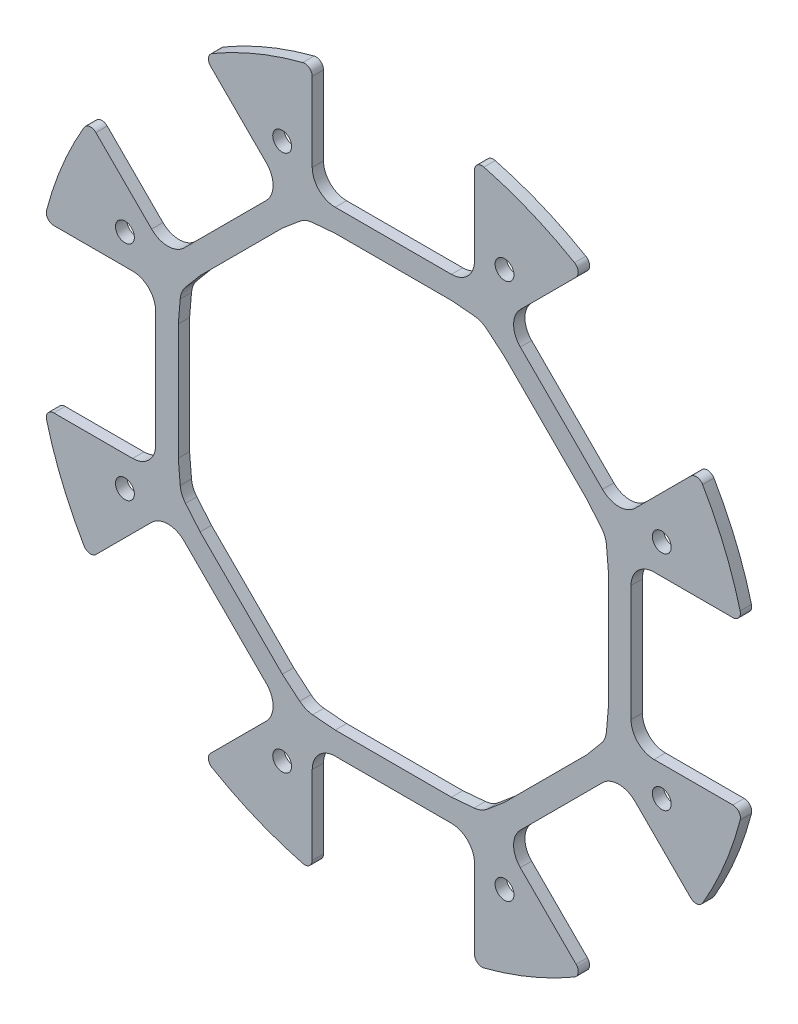
from build123d import *

# Parameters (mm, degrees)
SKETCH_1_R                       = 47.5
EXTRUDE_1_DEPTH                  = 1.5
CUT_EXTRUDE_1_DEPTH              = 68.191889392
CUT_EXTRUDE_2_DEPTH              = 68.191889392
CUT_EXTRUDE_2_DEPTH_BACK         = 68.191889392
SKETCH_3_R                       = 3.1
SKETCH_3_R_2                     = 1.6
SKETCH_4_R                       = 1.25
CUT_EXTRUDE_3_DEPTH              = 68.191889392
CUT_EXTRUDE_4_DEPTH              = 68.191889392
FILLET_1_R                       = 1
FILLET_2_R                       = 0.2
FILLET_3_R                       = 3.05
PATTERN_CIRCULAR_1_COUNT         = 8
FILLET_1_OF_PATTERN_CIRCULAR_1_R = 1
FILLET_2_OF_PATTERN_CIRCULAR_1_R = 0.2
FILLET_3_OF_PATTERN_CIRCULAR_1_R = 3.05
CUT_EXTRUDE_5_DEPTH              = 66.05834985
EXTRUDE_START                    = -1.5
EXTRUDE_2_DEPTH                  = 1.5
FILLET_4_R                       = 3.05
PATTERN_CIRCULAR_2_COUNT         = 8


with BuildPart() as part:
    # ｽｹｯﾁ1 → ﾎﾞｽ - 押し出し1 (new body)
    with BuildSketch(Plane.XY):
        Circle(SKETCH_1_R)
    extrude(amount=EXTRUDE_1_DEPTH)

    # ｽｹｯﾁ2 → ｶｯﾄ - 押し出し1 (cut, through all)
    with BuildSketch(Plane.XY.offset(1.5)):
        Polygon((-10.75, 43.525), (-10.75, 52.5), (10.75, 52.5), (10.75, 43.525), (13, 43.525), (13, 40.475), (10.75, 40.475), (10.75, 31.5), (-10.75, 31.5), (-10.75, 40.475), (-13, 40.475), (-13, 43.525), align=None)
    cut_extrude_1 = extrude(amount=-CUT_EXTRUDE_1_DEPTH, mode=Mode.SUBTRACT)

    # ｽｹｯﾁ3 → ｶｯﾄ - 押し出し2 (cut, two sides: drawn at the far end of the back side and taken through both)
    with BuildSketch(Plane.XY.offset(1.5).offset(-CUT_EXTRUDE_2_DEPTH_BACK)):
        Circle(SKETCH_3_R)
        with Locations((0, 6.5)):
            Circle(SKETCH_3_R_2)
        with Locations((6.5, 0)):
            Circle(SKETCH_3_R_2)
        with Locations((0, -6.5)):
            Circle(SKETCH_3_R_2)
        with Locations((-6.5, 0)):
            Circle(SKETCH_3_R_2)
        with Locations((8.838834765, 8.838834765)):
            Circle(SKETCH_3_R_2)
        with Locations((8.838834765, -8.838834765)):
            Circle(SKETCH_3_R_2)
        with Locations((-8.838834765, -8.838834765)):
            Circle(SKETCH_3_R_2)
        with Locations((-8.838834765, 8.838834765)):
            Circle(SKETCH_3_R_2)
    extrude(amount=CUT_EXTRUDE_2_DEPTH + CUT_EXTRUDE_2_DEPTH_BACK, mode=Mode.SUBTRACT)

    # ｽｹｯﾁ4 → ｶｯﾄ - 押し出し3 (cut, through all)
    with BuildSketch(Plane.XY.offset(1.5)):
        with Locations((14.733312146, 35.569362002)):
            Circle(SKETCH_4_R)
        with Locations((8.610377228, 20.787289482)):
            Circle(SKETCH_4_R)
    cut_extrude_3 = extrude(amount=-CUT_EXTRUDE_3_DEPTH, mode=Mode.SUBTRACT)

    # ｽｹｯﾁ5 → ｶｯﾄ - 押し出し4 (cut, symmetric)
    with BuildSketch(Plane.XY.offset(1.5)):
        Polygon((-7.188286702, 26.5), (7.188286702, 26.5), (3.328075632, 17.180626082), (-3.328075632, 17.180626082), align=None)
    cut_extrude_4 = extrude(amount=CUT_EXTRUDE_4_DEPTH, both=True, mode=Mode.SUBTRACT)

    # ﾌｨﾚｯﾄ1
    fillet_1_edges = [part.edges().sort_by_distance(p)[0] for p in [
        (7.188286702, 26.5, 0.75),
        (3.328075632, 17.180626082, 0.75),
        (-3.328075632, 17.180626082, 0.75),
        (-7.188286702, 26.5, 0.75),
        (10.75, 46.267564232, 0.75),
        (-10.75, 46.267564232, 0.75),
    ]]
    fillet(fillet_1_edges, radius=FILLET_1_R)

    # ﾌｨﾚｯﾄ2
    fillet_2_edges = [part.edges().sort_by_distance(p)[0] for p in [
        (13, 43.525, 0.75),
        (13, 40.475, 0.75),
        (-13, 40.475, 0.75),
        (-13, 43.525, 0.75),
    ]]
    fillet(fillet_2_edges, radius=FILLET_2_R)

    # ﾌｨﾚｯﾄ3
    fillet_3_edges = [part.edges().sort_by_distance(p)[0] for p in [
        (10.75, 31.5, 0.75),
        (-10.75, 31.5, 0.75),
    ]]
    fillet(fillet_3_edges, radius=FILLET_3_R)

    # 円形ﾊﾟﾀｰﾝ1: ｶｯﾄ - 押し出し1, ｶｯﾄ - 押し出し3, ｶｯﾄ - 押し出し4 ×8 about axis
    pattern_circular_1_axis = Axis((0, 0, 0), (0, 0, 1))
    add([cut_extrude_1.rotate(pattern_circular_1_axis, i * 360 / PATTERN_CIRCULAR_1_COUNT) for i in range(1, PATTERN_CIRCULAR_1_COUNT)], mode=Mode.SUBTRACT)
    add([cut_extrude_3.rotate(pattern_circular_1_axis, i * 360 / PATTERN_CIRCULAR_1_COUNT) for i in range(1, PATTERN_CIRCULAR_1_COUNT)], mode=Mode.SUBTRACT)
    add([cut_extrude_4.rotate(pattern_circular_1_axis, i * 360 / PATTERN_CIRCULAR_1_COUNT) for i in range(1, PATTERN_CIRCULAR_1_COUNT)], mode=Mode.SUBTRACT)

    # ﾌｨﾚｯﾄ1 of 円形ﾊﾟﾀｰﾝ1
    fillet_1_of_pattern_circular_1_edges = [part.edges().sort_by_distance(p)[0] for p in [
        (-13.655443429, 23.821215973, 0.75),
        (-9.79523236, 14.501842056, 0.75),
        (-14.501842056, 9.79523236, 0.75),
        (-23.821215973, 13.655443429, 0.75),
        (-25.11471052, 40.317506315, 0.75),
        (-40.317506315, 25.11471052, 0.75),
        (-26.5, 7.188286702, 0.75),
        (-17.180626082, 3.328075632, 0.75),
        (-17.180626082, -3.328075632, 0.75),
        (-26.5, -7.188286702, 0.75),
        (-46.267564232, 10.75, 0.75),
        (-46.267564232, -10.75, 0.75),
        (-23.821215973, -13.655443429, 0.75),
        (-14.501842056, -9.79523236, 0.75),
        (-9.79523236, -14.501842056, 0.75),
        (-13.655443429, -23.821215973, 0.75),
        (-40.317506315, -25.11471052, 0.75),
        (-25.11471052, -40.317506315, 0.75),
        (-7.188286702, -26.5, 0.75),
        (-3.328075632, -17.180626082, 0.75),
        (3.328075632, -17.180626082, 0.75),
        (7.188286702, -26.5, 0.75),
        (-10.75, -46.267564232, 0.75),
        (10.75, -46.267564232, 0.75),
        (13.655443429, -23.821215973, 0.75),
        (9.79523236, -14.501842056, 0.75),
        (14.501842056, -9.79523236, 0.75),
        (23.821215973, -13.655443429, 0.75),
        (25.11471052, -40.317506315, 0.75),
        (40.317506315, -25.11471052, 0.75),
        (26.5, -7.188286702, 0.75),
        (17.180626082, -3.328075632, 0.75),
        (17.180626082, 3.328075632, 0.75),
        (26.5, 7.188286702, 0.75),
        (46.267564232, -10.75, 0.75),
        (46.267564232, 10.75, 0.75),
        (23.821215973, 13.655443429, 0.75),
        (14.501842056, 9.79523236, 0.75),
        (9.79523236, 14.501842056, 0.75),
        (13.655443429, 23.821215973, 0.75),
        (40.317506315, 25.11471052, 0.75),
        (25.11471052, 40.317506315, 0.75),
    ]]
    fillet(fillet_1_of_pattern_circular_1_edges, radius=FILLET_1_OF_PATTERN_CIRCULAR_1_R)

    # ﾌｨﾚｯﾄ2 of 円形ﾊﾟﾀｰﾝ1
    fillet_2_of_pattern_circular_1_edges = [part.edges().sort_by_distance(p)[0] for p in [
        (-21.584434496, 39.969210807, 0.75),
        (-19.427758813, 37.812535124, 0.75),
        (-37.812535124, 19.427758813, 0.75),
        (-39.969210807, 21.584434496, 0.75),
        (-43.525, 13, 0.75),
        (-40.475, 13, 0.75),
        (-40.475, -13, 0.75),
        (-43.525, -13, 0.75),
        (-39.969210807, -21.584434496, 0.75),
        (-37.812535124, -19.427758813, 0.75),
        (-19.427758813, -37.812535124, 0.75),
        (-21.584434496, -39.969210807, 0.75),
        (-13, -43.525, 0.75),
        (-13, -40.475, 0.75),
        (13, -40.475, 0.75),
        (13, -43.525, 0.75),
        (21.584434496, -39.969210807, 0.75),
        (19.427758813, -37.812535124, 0.75),
        (37.812535124, -19.427758813, 0.75),
        (39.969210807, -21.584434496, 0.75),
        (43.525, -13, 0.75),
        (40.475, -13, 0.75),
        (40.475, 13, 0.75),
        (43.525, 13, 0.75),
        (39.969210807, 21.584434496, 0.75),
        (37.812535124, 19.427758813, 0.75),
        (19.427758813, 37.812535124, 0.75),
        (21.584434496, 39.969210807, 0.75),
    ]]
    fillet(fillet_2_of_pattern_circular_1_edges, radius=FILLET_2_OF_PATTERN_CIRCULAR_1_R)

    # ﾌｨﾚｯﾄ3 of 円形ﾊﾟﾀｰﾝ1
    fillet_3_of_pattern_circular_1_edges = [part.edges().sort_by_distance(p)[0] for p in [
        (-14.67246571, 29.875261505, 0.75),
        (-29.875261505, 14.67246571, 0.75),
        (-31.5, 10.75, 0.75),
        (-31.5, -10.75, 0.75),
        (-29.875261505, -14.67246571, 0.75),
        (-14.67246571, -29.875261505, 0.75),
        (-10.75, -31.5, 0.75),
        (10.75, -31.5, 0.75),
        (14.67246571, -29.875261505, 0.75),
        (29.875261505, -14.67246571, 0.75),
        (31.5, -10.75, 0.75),
        (31.5, 10.75, 0.75),
        (29.875261505, 14.67246571, 0.75),
        (14.67246571, 29.875261505, 0.75),
    ]]
    fillet(fillet_3_of_pattern_circular_1_edges, radius=FILLET_3_OF_PATTERN_CIRCULAR_1_R)

    # ｽｹｯﾁ6 → ｶｯﾄ - 押し出し5 (cut, through all)
    with BuildSketch(Plane.XY.offset(1.5)):
        Polygon((11.664524887, 28.160654182), (7.7, 28.5), (-7.7, 28.5), (-11.664524887, 28.160654182), (-14.707821049, 25.597265479), (-25.597265479, 14.707821049), (-28.160654182, 11.664524887), (-28.5, 7.7), (-28.5, -7.7), (-28.160654182, -11.664524887), (-25.597265479, -14.707821049), (-14.707821049, -25.597265479), (-11.664524887, -28.160654182), (-7.7, -28.5), (7.7, -28.5), (11.664524887, -28.160654182), (14.707821049, -25.597265479), (25.597265479, -14.707821049), (28.160654182, -11.664524887), (28.5, -7.7), (28.5, 7.7), (28.160654182, 11.664524887), (25.597265479, 14.707821049), (14.707821049, 25.597265479), align=None)
    extrude(amount=-CUT_EXTRUDE_5_DEPTH, mode=Mode.SUBTRACT)

    # ｽｹｯﾁ7 → ﾎﾞｽ - 押し出し2 (add)
    with BuildSketch(Plane.XY.offset(1.5).offset(EXTRUDE_START)):
        with BuildLine():
            Line((-12.8, 43.525), (-10.75, 43.525))
            Line((-10.75, 43.525), (-10.75, 40.475))
            Line((-10.75, 40.475), (-12.8, 40.475))
            ThreePointArc((-12.8, 40.475), (-12.941421356, 40.533578644), (-13, 40.675))
            Line((-13, 40.675), (-13, 43.325))
            ThreePointArc((-13, 43.325), (-12.941421356, 43.466421356), (-12.8, 43.525))
        make_face()
        with BuildLine():
            Line((12.8, 40.475), (10.75, 40.475))
            Line((10.75, 40.475), (10.75, 43.525))
            Line((10.75, 43.525), (12.8, 43.525))
            ThreePointArc((12.8, 43.525), (12.941421356, 43.466421356), (13, 43.325))
            Line((13, 43.325), (13, 40.675))
            ThreePointArc((13, 40.675), (12.941421356, 40.533578644), (12.8, 40.475))
        make_face()
    extrude_2 = extrude(amount=EXTRUDE_2_DEPTH)

    # ﾌｨﾚｯﾄ4
    fillet_4_edges = [part.edges().sort_by_distance(p)[0] for p in [
        (-11.664524887, 28.160654182, 0.75),
        (11.664524887, 28.160654182, 0.75),
        (28.160654182, 11.664524887, 0.75),
        (28.160654182, -11.664524887, 0.75),
        (11.664524887, -28.160654182, 0.75),
        (-11.664524887, -28.160654182, 0.75),
        (-28.160654182, -11.664524887, 0.75),
        (-28.160654182, 11.664524887, 0.75),
    ]]
    fillet(fillet_4_edges, radius=FILLET_4_R)

    # 円形ﾊﾟﾀｰﾝ2: ﾎﾞｽ - 押し出し2 ×8 about axis
    pattern_circular_2_axis = Axis((0, 0, 0), (0, 0, 1))
    for i in range(1, PATTERN_CIRCULAR_2_COUNT):
        add(extrude_2.rotate(pattern_circular_2_axis, i * 360 / PATTERN_CIRCULAR_2_COUNT))


solid = part.part
